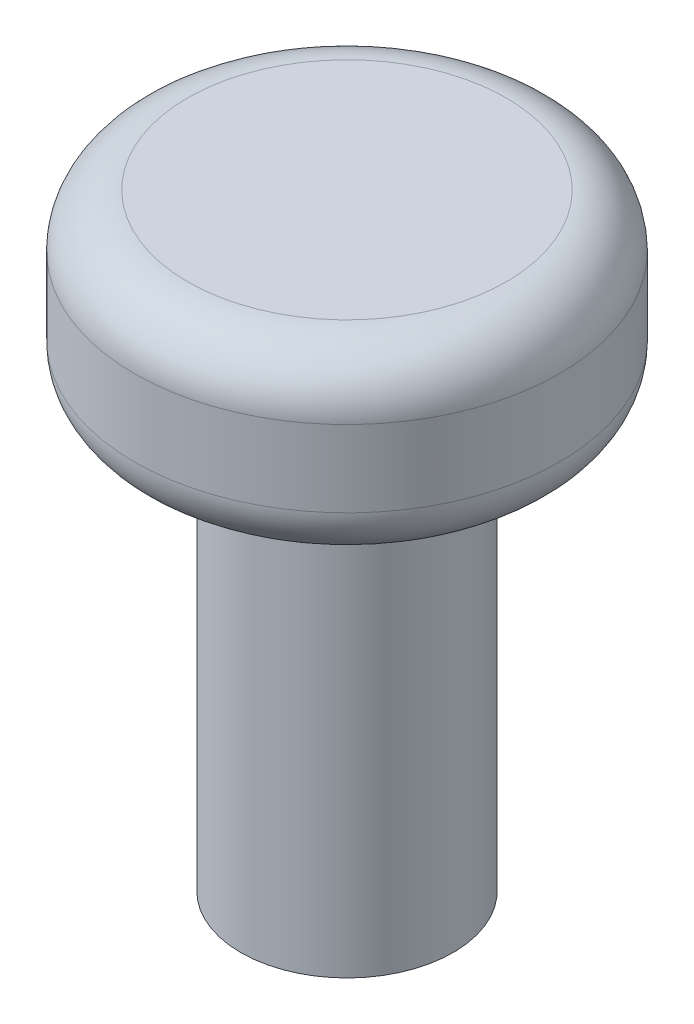
from build123d import *

# Parameters (mm, degrees)
FILLET1_R = 0.5


with BuildPart() as part:
    # Sketch1 → Revolve1 (revolve)
    with BuildSketch(Plane.XY, mode=Mode.PRIVATE) as revolve1_sk:
        Polygon((0, 0), (-1, 0), (-1, 4), (-2, 4), (-2, 5.72), (0, 5.72), align=None)
    revolve(revolve1_sk.sketch.rotate(Axis((0, 5.72, 0), (0, -1, 0)), 270), axis=Axis((0, 5.72, 0), (0, -1, 0)))

    # Fillet1
    fillet1_edges = [part.edges().sort_by_distance(p)[0] for p in [
        (0, 5.72, -2),
        (0, 4, -2),
    ]]
    fillet(fillet1_edges, radius=FILLET1_R)


solid = part.part
